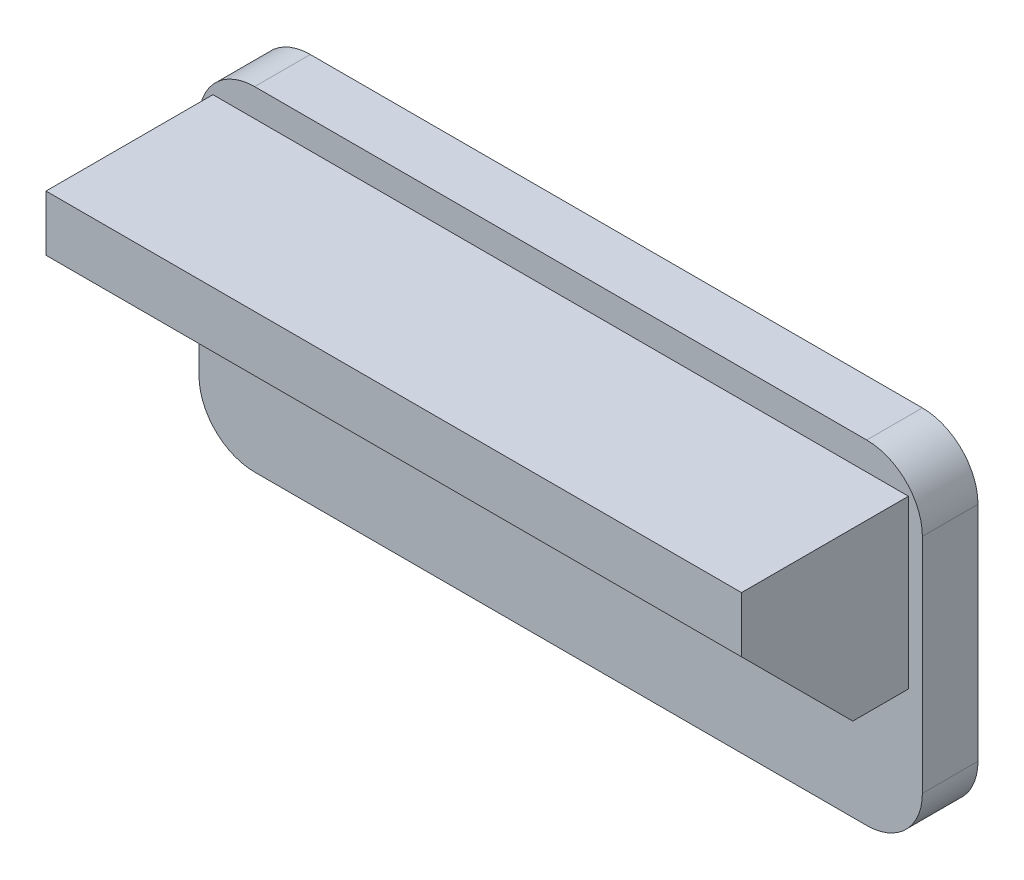
from build123d import *

# Parameters (mm, degrees)
SKETCH_2_W      = 13
SKETCH_2_H      = 6
EXTRUDE_1_DEPTH = 1
EXTRUDE_2_DEPTH = 3
CHAMFER_1_SIZE  = 2
FILLET_1_R      = 1
EXTRUDE_3_DEPTH = 0.2


with BuildPart() as part:
    # 草图2 → 凸台-拉伸1 (new body)
    with BuildSketch(Plane.XY):
        Rectangle(SKETCH_2_W, SKETCH_2_H)
    extrude(amount=EXTRUDE_1_DEPTH)

    # 草图3 → 凸台-拉伸2 (add)
    with BuildSketch(Plane.XY.offset(1)):
        Polygon((6.25, 2.5), (-6.25, 2.5), (-6.25, -0.5), (-5.25, -0.5), (-5.25, 1.5), (5.25, 1.5), (5.25, -0.5), (6.25, -0.5), align=None)
    extrude(amount=EXTRUDE_2_DEPTH)

    # 倒角1
    chamfer_1_edges = [part.edges().sort_by_distance(p)[0] for p in [
        (5.75, -0.5, 4),
        (-5.75, -0.5, 4),
    ]]
    chamfer(chamfer_1_edges, length=CHAMFER_1_SIZE)

    # 圆角1
    fillet_1_edges = [part.edges().sort_by_distance(p)[0] for p in [
        (-6.5, 3, 0.5),
        (6.5, 3, 0.5),
        (6.5, -3, 0.5),
        (-6.5, -3, 0.5),
    ]]
    fillet(fillet_1_edges, radius=FILLET_1_R)

    # 草图4 → 凸台-拉伸3 (add)
    # profile 1 of 3: a face of its own
    with BuildSketch(Plane(origin=(0, 0, 0), x_dir=(-1, 0, 0), z_dir=(0, 0, -1))):
        with BuildLine():
            add(Edge.make_bspline(
                [(-1.996229683, -0.918411954), (-1.997126548, -0.957942865), (-1.998873539, -1.034944619), (-2.011826195, -1.147327143), (-2.033780661, -1.253065142), (-2.064282963, -1.352854823), (-2.103526683, -1.446526108), (-2.15269759, -1.533591552), (-2.209755515, -1.61443614), (-2.275367662, -1.688985201), (-2.351147995, -1.755334145), (-2.436885247, -1.813688994), (-2.533482057, -1.861910577), (-2.639728574, -1.902486963), (-2.756395657, -1.933201565), (-2.882952117, -1.954973225), (-3.019583448, -1.967803118), (-3.114003864, -1.969505341), (-3.16289635, -1.97038678)],
                knots=[0, 0, 0, 0, 1.057107884, 2.059126875, 3.02060749, 3.941607407, 4.845852024, 5.731110654, 6.610366756, 7.488161519, 8.380590441, 9.297098867, 10.25403842, 11.261351409, 12.333917488, 13.474981367, 14.6925027, 16, 16, 16, 16], degree=3))
            add(Edge.make_bspline(
                [(-3.16289635, -1.97038678), (-3.211788836, -1.969505341), (-3.306209252, -1.967803118), (-3.442840582, -1.954973225), (-3.569397042, -1.933201565), (-3.686064125, -1.902486963), (-3.792310643, -1.861910577), (-3.888907453, -1.813688994), (-3.974644705, -1.755334145), (-4.050425037, -1.688985201), (-4.116037185, -1.61443614), (-4.17309511, -1.533591552), (-4.222266016, -1.446526108), (-4.261509737, -1.352854823), (-4.292012038, -1.253065142), (-4.313966505, -1.147327143), (-4.32691916, -1.034944619), (-4.328666152, -0.957942865), (-4.329563016, -0.918411954)],
                knots=[0, 0, 0, 0, 1.3074973, 2.525018633, 3.666082512, 4.738648591, 5.74596158, 6.702901133, 7.619409559, 8.511838481, 9.389633244, 10.268889346, 11.154147976, 12.058392593, 12.97939251, 13.940873125, 14.942892116, 16, 16, 16, 16], degree=3))
            Line((-4.329563016, -0.918411954), (-4.329563016, 1.52961322))
            Line((-4.329563016, 1.52961322), (-3.843451905, 1.52961322))
            Line((-3.843451905, 1.52961322), (-3.843451905, -0.914614211))
            add(Edge.make_bspline(
                [(-3.843451905, -0.914614211), (-3.842804895, -0.94222587), (-3.841549324, -0.995808298), (-3.833715991, -1.073477345), (-3.818176816, -1.145320423), (-3.797697121, -1.211689902), (-3.77236864, -1.27317531), (-3.73923938, -1.32793787), (-3.700966776, -1.377408101), (-3.656583539, -1.420536602), (-3.607863001, -1.458639711), (-3.554944664, -1.491315175), (-3.498662395, -1.51966566), (-3.438524185, -1.542324221), (-3.374662895, -1.559836552), (-3.30738069, -1.572643659), (-3.236250413, -1.580438082), (-3.187728438, -1.581139121), (-3.16289635, -1.581497891)],
                knots=[0, 0, 0, 0, 1.220177701, 2.367843409, 3.442937104, 4.461976721, 5.434388762, 6.3725439, 7.281085205, 8.190796558, 9.099337863, 10.008842846, 10.934374079, 11.879705013, 12.843196247, 13.856818022, 14.903183881, 16, 16, 16, 16], degree=3))
            add(Edge.make_bspline(
                [(-3.16289635, -1.581497891), (-3.138064261, -1.581139121), (-3.089542287, -1.580438082), (-3.018412009, -1.572643659), (-2.951129804, -1.559836552), (-2.887268514, -1.542324221), (-2.827130305, -1.51966566), (-2.770848035, -1.491315175), (-2.717929698, -1.458639711), (-2.66920916, -1.420536602), (-2.624825923, -1.377408101), (-2.586553319, -1.32793787), (-2.55342406, -1.27317531), (-2.528095578, -1.211689902), (-2.507615884, -1.145320423), (-2.492076708, -1.073477345), (-2.484243376, -0.995808298), (-2.482987805, -0.94222587), (-2.482340794, -0.914614211)],
                knots=[0, 0, 0, 0, 1.096816119, 2.143181978, 3.156803753, 4.120294987, 5.065625921, 5.991157154, 6.900662137, 7.809203442, 8.718914795, 9.6274561, 10.565611238, 11.538023279, 12.557062896, 13.632156591, 14.779822299, 16, 16, 16, 16], degree=3))
            Line((-2.482340794, -0.914614211), (-2.482340794, 1.52961322))
            Line((-2.482340794, 1.52961322), (-1.996229683, 1.52961322))
            Line((-1.996229683, 1.52961322), (-1.996229683, -0.918411954))
        make_face()
    # profile 2 of 3: a face of its own
    with BuildSketch(Plane(origin=(0, 0, 0), x_dir=(-1, 0, 0), z_dir=(0, 0, -1))):
        with BuildLine():
            add(Edge.make_bspline(
                [(1.158631428, -0.947274801), (1.157604476, -0.985557747), (1.155596568, -1.060408999), (1.140077321, -1.169574276), (1.115121873, -1.272689751), (1.080249021, -1.37000231), (1.034244365, -1.460840336), (0.978444098, -1.545690484), (0.912619298, -1.624613105), (0.836634491, -1.696367821), (0.752149843, -1.761061383), (0.660029846, -1.817393394), (0.560380396, -1.864657845), (0.453522941, -1.903333178), (0.339443794, -1.933767639), (0.217914983, -1.95461724), (0.089476105, -1.967771275), (0.00136557, -1.969501275), (-0.043734023, -1.97038678)],
                knots=[0, 0, 0, 0, 1.030438043, 2.014724244, 2.96208392, 3.882852976, 4.791326948, 5.696957649, 6.611650626, 7.551895803, 8.504928343, 9.471781211, 10.453585746, 11.469284805, 12.527532432, 13.62807703, 14.785925406, 16, 16, 16, 16], degree=3))
            add(Edge.make_bspline(
                [(-0.043734023, -1.97038678), (-0.088837246, -1.969561245), (-0.176729144, -1.967952539), (-0.304737282, -1.954036006), (-0.425230943, -1.931535759), (-0.538166373, -1.899640943), (-0.643452224, -1.858847285), (-0.740798693, -1.808116287), (-0.830908464, -1.748853181), (-0.91265985, -1.680532763), (-0.98547071, -1.605453873), (-1.048809174, -1.525119345), (-1.103430521, -1.440852027), (-1.146580302, -1.35100218), (-1.181291229, -1.257268691), (-1.205095371, -1.158589049), (-1.221247875, -1.05566274), (-1.222616985, -0.985316345), (-1.223313016, -0.949553447)],
                knots=[0, 0, 0, 0, 1.233483706, 2.403669096, 3.517488228, 4.582973885, 5.609294366, 6.600548044, 7.58019291, 8.553846008, 9.508921786, 10.435886308, 11.348457392, 12.249816584, 13.156904811, 14.077404505, 15.022585474, 16, 16, 16, 16], degree=3))
            Line((-1.223313016, -0.949553447), (-1.223313016, -0.803720114))
            Line((-1.223313016, -0.803720114), (-0.737201905, -0.803720114))
            Line((-0.737201905, -0.803720114), (-0.737201905, -0.929805183))
            add(Edge.make_bspline(
                [(-0.737201905, -0.929805183), (-0.73671949, -0.955410611), (-0.735784177, -1.005054807), (-0.725633232, -1.077361028), (-0.708930076, -1.145007509), (-0.686350874, -1.2083218), (-0.65698569, -1.266929751), (-0.621519681, -1.321174156), (-0.578074973, -1.369921206), (-0.529860406, -1.414633692), (-0.476707908, -1.453673553), (-0.421266999, -1.48784541), (-0.363771942, -1.517267851), (-0.303865434, -1.5404853), (-0.241925126, -1.559067499), (-0.177786936, -1.571543242), (-0.111593947, -1.580664011), (-0.066553118, -1.581217484), (-0.043734023, -1.581497891)],
                knots=[0, 0, 0, 0, 1.148678161, 2.227074802, 3.268925595, 4.271871523, 5.237489331, 6.20511119, 7.171531118, 8.160733859, 9.151697503, 10.126234835, 11.081701762, 12.04611514, 13.006166608, 13.980107426, 14.976659133, 16, 16, 16, 16], degree=3))
            add(Edge.make_bspline(
                [(-0.043734023, -1.581497891), (-0.013828438, -1.581264813), (0.043833142, -1.580815409), (0.127206709, -1.571622304), (0.204713084, -1.559809694), (0.275845277, -1.54006417), (0.341343974, -1.517246089), (0.400445653, -1.488064985), (0.453368707, -1.453809097), (0.499795253, -1.414166063), (0.539844769, -1.370327971), (0.575696363, -1.325230859), (0.605871196, -1.277408685), (0.629928644, -1.227332054), (0.649315044, -1.175018705), (0.662975682, -1.120540045), (0.670442905, -1.063690645), (0.671820491, -1.025275361), (0.672520317, -1.005760044)],
                knots=[0, 0, 0, 0, 1.382378453, 2.665392611, 3.87642127, 5.004237092, 6.0748435, 7.08044695, 8.045189792, 8.983920886, 9.895447329, 10.788044129, 11.64585096, 12.504856126, 13.353338693, 14.222502439, 15.097014936, 16, 16, 16, 16], degree=3))
            add(Edge.make_bspline(
                [(0.672520317, -1.005760044), (0.671998723, -0.989251435), (0.670954061, -0.95618757), (0.660508535, -0.907464493), (0.644408855, -0.859816155), (0.622074401, -0.813257299), (0.59377082, -0.767275385), (0.558652182, -0.722665007), (0.517166937, -0.678976671), (0.451137649, -0.621062042), (0.354375579, -0.55005725), (0.218234616, -0.472469716), (0.0607051, -0.396995063), (-0.053999895, -0.35344358), (-0.114372044, -0.330521329)],
                knots=[0, 0, 0, 0, 0.540979496, 1.083487546, 1.627266108, 2.188345489, 2.773918656, 3.395394599, 4.04764328, 4.747853927, 6.27474702, 7.975928031, 9.882028801, 12, 12, 12, 12], degree=3))
            add(Edge.make_bspline(
                [(-0.114372044, -0.330521329), (-0.157783032, -0.315652339), (-0.242075297, -0.286780827), (-0.362541858, -0.239574832), (-0.473957818, -0.19187322), (-0.575938875, -0.142604797), (-0.668437914, -0.091849058), (-0.751816835, -0.040496203), (-0.824888171, 0.012957492), (-0.889578621, 0.067032241), (-0.945764961, 0.123580398), (-0.993261129, 0.183187855), (-1.035352492, 0.243873789), (-1.067947358, 0.308549251), (-1.093584307, 0.375289118), (-1.113326598, 0.444271048), (-1.123681852, 0.516058842), (-1.125282007, 0.564704452), (-1.126090794, 0.589292039)],
                knots=[0, 0, 0, 0, 1.501343071, 2.915197591, 4.232553842, 5.466403709, 6.61951227, 7.683850157, 8.668150378, 9.579343846, 10.440504429, 11.271157354, 12.070782601, 12.852570096, 13.63413808, 14.407983961, 15.19532651, 16, 16, 16, 16], degree=3))
            add(Edge.make_bspline(
                [(-1.126090794, 0.589292039), (-1.125074791, 0.623535164), (-1.123085085, 0.690595699), (-1.107290039, 0.788592636), (-1.082782827, 0.881914605), (-1.046141106, 0.969603012), (-1.001751661, 1.053567371), (-0.944644447, 1.130748377), (-0.878791678, 1.203852033), (-0.803232682, 1.270541248), (-0.720771001, 1.33074465), (-0.634114622, 1.384249289), (-0.543173745, 1.429490558), (-0.448065832, 1.465498846), (-0.349677321, 1.494853261), (-0.247221381, 1.515212371), (-0.141014053, 1.527642897), (-0.068833294, 1.528951585), (-0.032340794, 1.52961322)],
                knots=[0, 0, 0, 0, 1.020620433, 1.99874729, 2.952950106, 3.890915243, 4.826690007, 5.778110928, 6.745602631, 7.756317298, 8.777133191, 9.787142633, 10.78995887, 11.800899106, 12.816227905, 13.848261891, 14.912143571, 16, 16, 16, 16], degree=3))
            add(Edge.make_bspline(
                [(-0.032340794, 1.52961322), (0.014283134, 1.528852528), (0.104480396, 1.527380916), (0.234880246, 1.512873759), (0.355354081, 1.488663572), (0.466097448, 1.45570646), (0.566590786, 1.412504291), (0.656216197, 1.358468368), (0.737083302, 1.296468161), (0.80555997, 1.22351985), (0.865046257, 1.145847894), (0.918074661, 1.066241866), (0.961571127, 0.983945158), (0.999392905, 0.900761615), (1.025782569, 0.814448547), (1.0469819, 0.726844826), (1.05936388, 0.63699248), (1.060725487, 0.576415813), (1.061409206, 0.545997768)],
                knots=[0, 0, 0, 0, 1.348008105, 2.607816308, 3.788219387, 4.897750037, 5.943831261, 6.942156196, 7.917664227, 8.880921406, 9.825603763, 10.745587084, 11.64321117, 12.515295685, 13.383683603, 14.248638106, 15.120568909, 16, 16, 16, 16], degree=3))
            Line((1.061409206, 0.545997768), (0.575298095, 0.545997768))
            add(Edge.make_bspline(
                [(0.575298095, 0.545997768), (0.576412258, 0.564471218), (0.578626089, 0.601177763), (0.575667961, 0.655998802), (0.56614388, 0.709596903), (0.552155507, 0.762029638), (0.531056232, 0.812831004), (0.504407134, 0.862073156), (0.472129727, 0.910403078), (0.434634058, 0.956752447), (0.392554687, 1.000610759), (0.344127447, 1.037447902), (0.292474666, 1.069775254), (0.236026018, 1.095793886), (0.175211311, 1.116323783), (0.109734659, 1.130541602), (0.040033868, 1.138914729), (-0.007758437, 1.140109692), (-0.032340794, 1.140724331)],
                knots=[0, 0, 0, 0, 0.920688915, 1.829398903, 2.724374449, 3.626243361, 4.524848935, 5.455146493, 6.40929198, 7.412994968, 8.419936097, 9.42569375, 10.432871409, 11.447667112, 12.51165807, 13.621524014, 14.776611738, 16, 16, 16, 16], degree=3))
            add(Edge.make_bspline(
                [(-0.032340794, 1.140724331), (-0.076758293, 1.139472087), (-0.161479282, 1.137083585), (-0.28136481, 1.113607104), (-0.386931215, 1.073940815), (-0.463230243, 1.027370358), (-0.51493899, 0.982866624), (-0.548698724, 0.947245989), (-0.576575908, 0.908428909), (-0.600076601, 0.867311996), (-0.618146485, 0.823403293), (-0.631162528, 0.776506711), (-0.638880178, 0.727029427), (-0.639609004, 0.693124544), (-0.639979683, 0.675880581)],
                knots=[0, 0, 0, 0, 1.856745707, 3.541517153, 5.083836879, 6.553628232, 7.252184167, 7.934159632, 8.601583504, 9.246695175, 9.911592512, 10.582370294, 11.278996068, 12, 12, 12, 12], degree=3))
            add(Edge.make_bspline(
                [(-0.639979683, 0.675880581), (-0.638312434, 0.647620368), (-0.635037421, 0.59210824), (-0.610773585, 0.511753246), (-0.56909592, 0.438685858), (-0.521984333, 0.381838437), (-0.470353335, 0.340356608), (-0.419162514, 0.305879099), (-0.354213595, 0.271864735), (-0.277056058, 0.235453869), (-0.18763501, 0.196522458), (-0.084767872, 0.157899257), (0.02998633, 0.115300838), (0.111608805, 0.088935037), (0.154508164, 0.075077629)],
                knots=[0, 0, 0, 0, 0.949767553, 1.865648258, 2.791919141, 3.764429581, 4.326983758, 5.01420426, 5.83714567, 6.789314758, 7.883883305, 9.115701087, 10.484062452, 12, 12, 12, 12], degree=3))
            add(Edge.make_bspline(
                [(0.154508164, 0.075077629), (0.193647075, 0.059735355), (0.270033742, 0.02979213), (0.379770778, -0.020164762), (0.482963741, -0.071250025), (0.579131778, -0.125548214), (0.668496258, -0.18169344), (0.751971772, -0.238936071), (0.827174362, -0.300401104), (0.896557993, -0.36290608), (0.957988074, -0.4281984), (1.012144603, -0.495269574), (1.056505274, -0.565525973), (1.094875104, -0.637075427), (1.122448978, -0.711964436), (1.143123727, -0.78843375), (1.156895278, -0.867027598), (1.15804956, -0.920380057), (1.158631428, -0.947274801)],
                knots=[0, 0, 0, 0, 1.322789994, 2.581664054, 3.793224843, 4.945618855, 6.055437864, 7.114227675, 8.128424404, 9.109819955, 10.051161733, 10.947131877, 11.817983913, 12.662633327, 13.497301751, 14.322637995, 15.154449066, 16, 16, 16, 16], degree=3))
        make_face()
    # profile 3 of 3: a face of its own
    with BuildSketch(Plane(origin=(0, 0, 0), x_dir=(-1, 0, 0), z_dir=(0, 0, -1))):
        with BuildLine():
            add(Edge.make_bspline(
                [(4.36210365, -0.917652405), (4.36121681, -0.965554342), (4.359507578, -1.057877119), (4.342746694, -1.190733958), (4.314782121, -1.312160385), (4.276536127, -1.422484484), (4.22604795, -1.521063748), (4.163906818, -1.607621784), (4.091320348, -1.683457505), (4.006330306, -1.745291592), (3.913769814, -1.798146359), (3.815039098, -1.844647962), (3.709668097, -1.883193439), (3.598469564, -1.915026919), (3.481036518, -1.94034255), (3.357108923, -1.957241169), (3.227027456, -1.968181134), (3.138240601, -1.969641159), (3.092897921, -1.97038678)],
                knots=[0, 0, 0, 0, 1.214096887, 2.339963761, 3.387918394, 4.368573714, 5.293055271, 6.185558513, 7.061729054, 7.942473337, 8.839834496, 9.761660036, 10.706096335, 11.681336946, 12.692365663, 13.74909191, 14.850480694, 16, 16, 16, 16], degree=3))
            Line((3.092897921, -1.97038678), (1.980159206, -1.97038678))
            Line((1.980159206, -1.97038678), (1.980159206, 1.52961322))
            Line((1.980159206, 1.52961322), (3.144547227, 1.52961322))
            add(Edge.make_bspline(
                [(3.144547227, 1.52961322), (3.189903919, 1.529081123), (3.277778733, 1.528050231), (3.40489985, 1.514541063), (3.523553248, 1.494379386), (3.633615016, 1.466088553), (3.73460935, 1.428327353), (3.827510224, 1.384079055), (3.910600034, 1.329398364), (3.985296255, 1.268041432), (4.050146103, 1.200073254), (4.10755825, 1.12933714), (4.156518467, 1.055508098), (4.196567137, 0.978194605), (4.226748427, 0.897213003), (4.24906852, 0.8133316), (4.262128246, 0.726166403), (4.263956152, 0.66706196), (4.264881428, 0.637143602)],
                knots=[0, 0, 0, 0, 1.351264111, 2.61796166, 3.805207185, 4.93632989, 5.998818899, 7.01464861, 7.996269277, 8.955682505, 9.889591814, 10.791143633, 11.668074067, 12.525303062, 13.380237285, 14.238661118, 15.108419509, 16, 16, 16, 16], degree=3))
            add(Edge.make_bspline(
                [(4.264881428, 0.637143602), (4.264355675, 0.607744351), (4.263333206, 0.550569545), (4.253832581, 0.468106975), (4.240172824, 0.391302385), (4.218295564, 0.321095305), (4.192131425, 0.256114488), (4.15949496, 0.197225306), (4.120160803, 0.144782039), (4.060810747, 0.084589842), (3.981380583, 0.020385843), (3.884002822, -0.045580147), (3.78509354, -0.098756565), (3.716096906, -0.122278834), (3.682307643, -0.133798239)],
                knots=[0, 0, 0, 0, 1.010202255, 1.964611943, 2.850529142, 3.687511313, 4.4875678, 5.255152423, 5.994947134, 6.733563379, 8.155508563, 9.497649804, 10.774540693, 12, 12, 12, 12], degree=3))
            add(Edge.make_bspline(
                [(3.682307643, -0.133798239), (3.726292477, -0.145703434), (3.81365101, -0.169348411), (3.937038421, -0.227240652), (4.05264663, -0.300478407), (4.140747474, -0.375113184), (4.205831205, -0.441679819), (4.247583246, -0.497515371), (4.282937985, -0.55740204), (4.311620624, -0.621433476), (4.334874177, -0.68947051), (4.350248598, -0.761910113), (4.360720031, -0.83835367), (4.361634731, -0.890777472), (4.36210365, -0.917652405)],
                knots=[0, 0, 0, 0, 1.45316007, 2.886129614, 4.333178494, 5.813891188, 6.563203784, 7.302366613, 8.034684783, 8.780278683, 9.539820685, 10.326642031, 11.142157131, 12, 12, 12, 12], degree=3))
        make_face()
        with BuildLine():
            add(Edge.make_bspline(
                [(3.778770317, 0.636384053), (3.778041941, 0.657406983), (3.776624264, 0.698325014), (3.769834313, 0.757936977), (3.75466723, 0.812622854), (3.736288968, 0.863625375), (3.710596276, 0.909089427), (3.681077717, 0.951386243), (3.643868388, 0.987359808), (3.58893735, 1.031298527), (3.510067473, 1.075515694), (3.405662353, 1.113522686), (3.2908894, 1.136809712), (3.210993866, 1.139388605), (3.169612331, 1.140724331)],
                knots=[0, 0, 0, 0, 0.845315215, 1.645281317, 2.402790008, 3.120741521, 3.81733108, 4.494943814, 5.185490554, 5.887702635, 7.318551937, 8.792577877, 10.338730048, 12, 12, 12, 12], degree=3))
            Line((3.169612331, 1.140724331), (2.466270317, 1.140724331))
            Line((2.466270317, 1.140724331), (2.466270317, 0.071279886))
            Line((2.466270317, 0.071279886), (3.146066324, 0.071279886))
            add(Edge.make_bspline(
                [(3.146066324, 0.071279886), (3.187708626, 0.072850778), (3.268703837, 0.075906198), (3.385940795, 0.100691775), (3.493971388, 0.142144489), (3.576891831, 0.189340139), (3.636040012, 0.236344684), (3.674221457, 0.278138365), (3.707418945, 0.324443556), (3.733054406, 0.377080439), (3.753526969, 0.43440951), (3.768995763, 0.496932135), (3.776898291, 0.565036268), (3.778132125, 0.612060897), (3.778770317, 0.636384053)],
                knots=[0, 0, 0, 0, 1.554696485, 3.023919482, 4.452043441, 5.863437086, 6.56954581, 7.265637394, 7.97155604, 8.690658831, 9.444622919, 10.24296498, 11.091186116, 12, 12, 12, 12], degree=3))
        make_face(mode=Mode.SUBTRACT)
        with BuildLine():
            add(Edge.make_bspline(
                [(3.827381428, -0.918411954), (3.826729811, -0.891778066), (3.825469758, -0.840275269), (3.813622158, -0.766227268), (3.795974012, -0.698125228), (3.769745294, -0.636131037), (3.735604558, -0.580579153), (3.693638715, -0.531495887), (3.645713961, -0.487069014), (3.569651059, -0.440009401), (3.467504503, -0.390632378), (3.336738409, -0.347897965), (3.198722737, -0.322229657), (3.104400983, -0.319166552), (3.056439588, -0.317609003)],
                knots=[0, 0, 0, 0, 0.866253386, 1.67510178, 2.434722173, 3.151046633, 3.85773122, 4.547787893, 5.247907508, 5.974772253, 7.449027636, 8.931826037, 10.439873103, 12, 12, 12, 12], degree=3))
            Line((3.056439588, -0.317609003), (2.466270317, -0.317609003))
            Line((2.466270317, -0.317609003), (2.466270317, -1.581497891))
            Line((2.466270317, -1.581497891), (2.988080213, -1.581497891))
            add(Edge.make_bspline(
                [(2.988080213, -1.581497891), (3.021260316, -1.581097764), (3.08541682, -1.580324084), (3.178724965, -1.573319626), (3.265759933, -1.562251511), (3.347000332, -1.546325986), (3.422012998, -1.525694034), (3.491636384, -1.502116902), (3.554439221, -1.471863904), (3.611741813, -1.437816958), (3.663856217, -1.398559468), (3.707226018, -1.350238134), (3.745111205, -1.295917916), (3.775248129, -1.233777944), (3.798866571, -1.164894521), (3.815085863, -1.088893725), (3.826238918, -1.00608928), (3.826991597, -0.948327968), (3.827381428, -0.918411954)],
                knots=[0, 0, 0, 0, 1.29022492, 2.494757742, 3.636692837, 4.700703348, 5.711105968, 6.660919749, 7.55499816, 8.41621199, 9.251305884, 10.080574554, 10.929999695, 11.819512014, 12.756789841, 13.755368835, 14.837449935, 16, 16, 16, 16], degree=3))
        make_face(mode=Mode.SUBTRACT)
    extrude(amount=EXTRUDE_3_DEPTH)


solid = part.part
